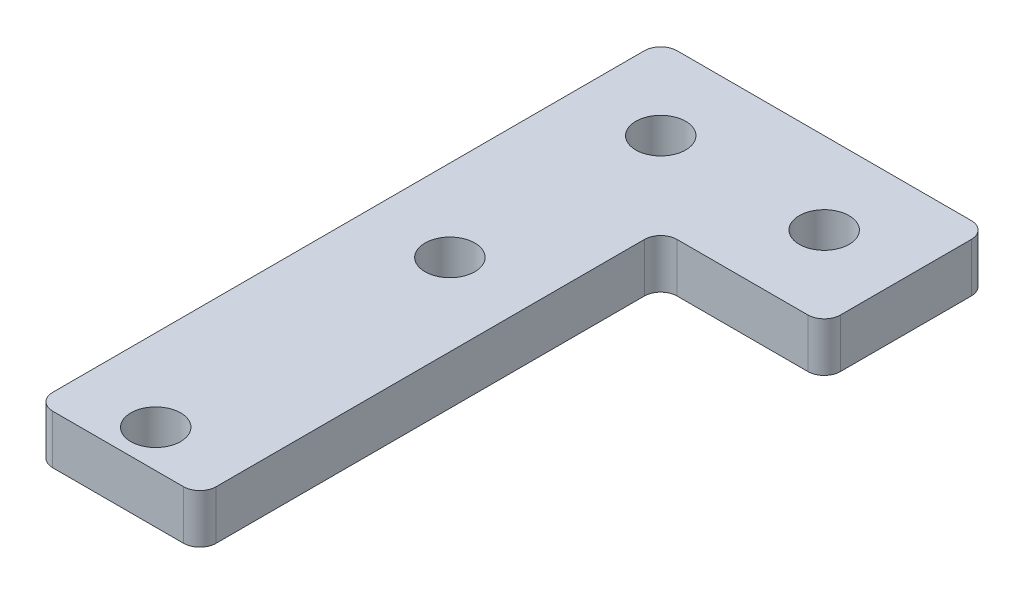
from build123d import *

# Parameters (mm, degrees)
SKETCH1_R           = 1.525
BOSS_EXTRUDE1_DEPTH = 3
FILLET1_R           = 1


with BuildPart() as part:
    # Sketch1 → Boss-Extrude1 (new body)
    with BuildSketch(Plane(origin=(0, 0, 0), x_dir=(1, 0, 0), z_dir=(0, 1, 0))):
        Polygon((10, 5.6), (20, 5.6), (20, 15.6), (0, 15.6), (0, 0), (0, -22.6), (10, -22.6), align=None)
        with Locations(Location((5, 10.6, 0), (0, 0, 270))):
            Circle(SKETCH1_R, mode=Mode.SUBTRACT)
        with Locations(Location((15, 10.6, 0), (0, 0, 270))):
            Circle(SKETCH1_R, mode=Mode.SUBTRACT)
        with Locations(Location((5, -2.3, 0), (0, 0, 270))):
            Circle(SKETCH1_R, mode=Mode.SUBTRACT)
        with Locations(Location((5, -20.3, 0), (0, 0, 270))):
            Circle(SKETCH1_R, mode=Mode.SUBTRACT)
    extrude(amount=BOSS_EXTRUDE1_DEPTH)

    # Fillet1
    fillet1_edges = [part.edges().sort_by_distance(p)[0] for p in [
        (10, 1.5, 22.6),
        (0, 1.5, 22.6),
        (0, 1.5, -15.6),
        (20, 1.5, -15.6),
        (20, 1.5, -5.6),
        (10, 1.5, -5.6),
    ]]
    fillet(fillet1_edges, radius=FILLET1_R)


solid = part.part
